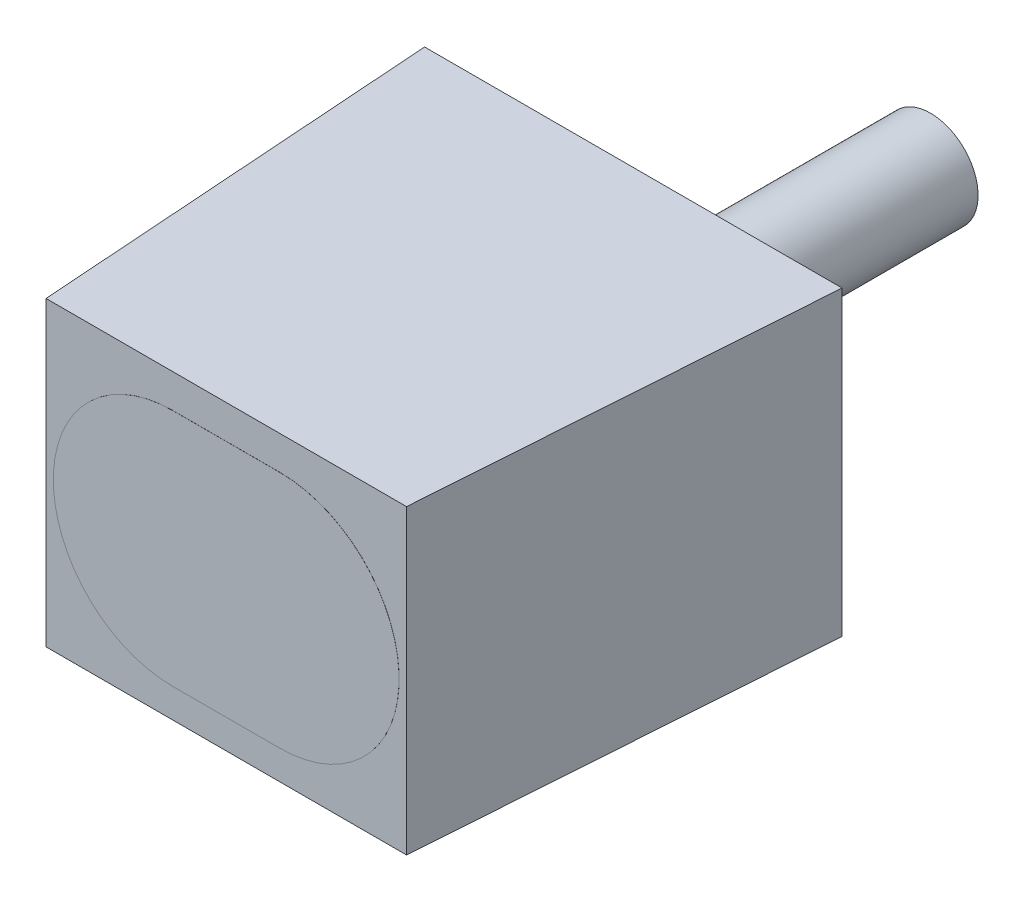
from build123d import *

# Parameters (mm, degrees)
SKETCH1_W           = 44
SKETCH1_H           = 42.9
BOSS_EXTRUDE1_DEPTH = 31.8
SKETCH2_OUTSIDE_W   = 59.838
SKETCH2_OUTSIDE_H   = 58.738
CUT_EXTRUDE1_DEPTH  = 31.8
SKETCH6_R           = 5
BOSS_EXTRUDE2_DEPTH = 31.8
BOSS_EXTRUDE3_DEPTH = 0.01


with BuildPart() as part:
    # Sketch1 → Boss-Extrude1 (new body)
    with BuildSketch(Plane(origin=(0, 0, 0), x_dir=(1, 0, 0), z_dir=(0, 1, 0))):
        Rectangle(SKETCH1_W, SKETCH1_H)
    extrude(amount=BOSS_EXTRUDE1_DEPTH)

    # Sketch2 outside → Cut-Extrude1 (cut)
    with BuildSketch(Plane(origin=(0, 31.8, 0), x_dir=(1, 0, 0), z_dir=(0, 1, 0))):
        Rectangle(SKETCH2_OUTSIDE_W, SKETCH2_OUTSIDE_H)
        Polygon((-22, 21.45), (-19, -21.45), (19, -21.45), (22, 21.45), align=None, mode=Mode.SUBTRACT)
    extrude(amount=-CUT_EXTRUDE1_DEPTH, mode=Mode.SUBTRACT)

    # Sketch6 → Boss-Extrude2 (add)
    with BuildSketch(Plane(origin=(0, 0, -21.45), x_dir=(-1, 0, 0), z_dir=(0, 0, -1))):
        with Locations((0.467474435, 15.619515339)):
            Circle(SKETCH6_R)
    extrude(amount=BOSS_EXTRUDE2_DEPTH)

    # Sketch7 → Boss-Extrude3 (add)
    with BuildSketch(Plane.XY.offset(21.45)):
        with BuildLine():
            Line((5.634249571, 3.078676804), (-5.634249571, 3.078676804))
            ThreePointArc((-5.634249571, 3.078676804), (-18.221835549, 15.666262783), (-5.634249571, 28.253848761))
            Line((-5.634249571, 28.253848761), (5.634249571, 28.253848761))
            ThreePointArc((5.634249571, 28.253848761), (18.221835549, 15.666262783), (5.634249571, 3.078676804))
        make_face()
    extrude(amount=BOSS_EXTRUDE3_DEPTH)


solid = part.part
